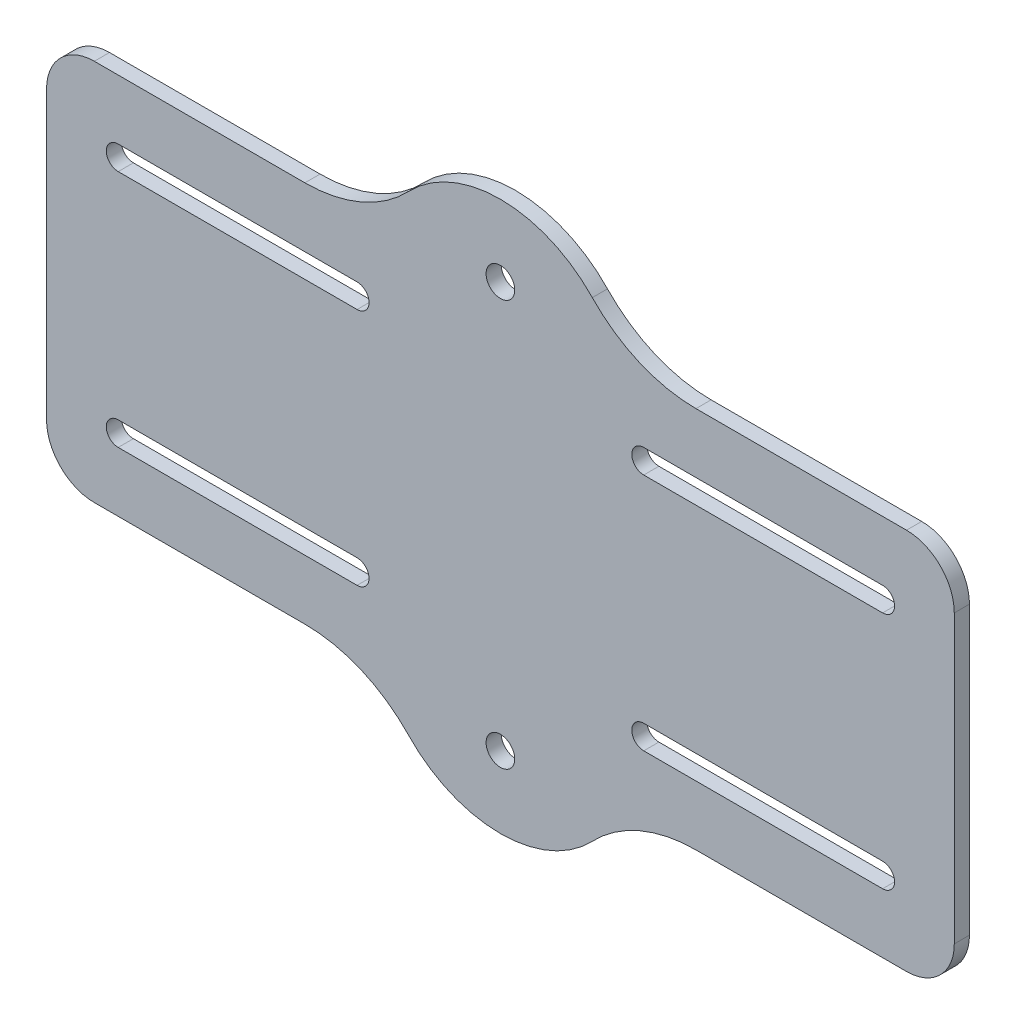
from build123d import *

# Parameters (mm, degrees)
SKETCH1_R           = 3
BOSS_EXTRUDE1_DEPTH = 3.175
FILLET1_R           = 10
FILLET2_R           = 30


with BuildPart() as part:
    # Sketch1 → Boss-Extrude1 (new body)
    with BuildSketch(Plane.XY):
        with BuildLine():
            Line((-95, -40), (-25, -40))
            ThreePointArc((-25, -40), (0, -57.5), (25, -40))
            Line((25, -40), (95, -40))
            Line((95, -40), (95, 40))
            Line((95, 40), (25, 40))
            ThreePointArc((25, 40), (0, 57.5), (-25, 40))
            Line((-25, 40), (-95, 40))
            Line((-95, 40), (-95, -40))
        make_face()
        with Locations((0, 42.5)):
            Circle(SKETCH1_R, mode=Mode.SUBTRACT)
        with Locations((0, -42.5)):
            Circle(SKETCH1_R, mode=Mode.SUBTRACT)
        with BuildLine():
            Line((30, 27.5), (80, 27.5))
            ThreePointArc((80, 27.5), (82.5, 25), (80, 22.5))
            Line((80, 22.5), (30, 22.5))
            ThreePointArc((30, 22.5), (27.5, 25), (30, 27.5))
        make_face(mode=Mode.SUBTRACT)
        with BuildLine():
            Line((30, -27.5), (80, -27.5))
            ThreePointArc((80, -27.5), (82.5, -25), (80, -22.5))
            Line((80, -22.5), (30, -22.5))
            ThreePointArc((30, -22.5), (27.5, -25), (30, -27.5))
        make_face(mode=Mode.SUBTRACT)
        with BuildLine():
            Line((-30, 27.5), (-80, 27.5))
            ThreePointArc((-80, 27.5), (-82.5, 25), (-80, 22.5))
            Line((-80, 22.5), (-30, 22.5))
            ThreePointArc((-30, 22.5), (-27.5, 25), (-30, 27.5))
        make_face(mode=Mode.SUBTRACT)
        with BuildLine():
            Line((-30, -27.5), (-80, -27.5))
            ThreePointArc((-80, -27.5), (-82.5, -25), (-80, -22.5))
            Line((-80, -22.5), (-30, -22.5))
            ThreePointArc((-30, -22.5), (-27.5, -25), (-30, -27.5))
        make_face(mode=Mode.SUBTRACT)
    extrude(amount=BOSS_EXTRUDE1_DEPTH)

    # Fillet1
    fillet1_edges = [part.edges().sort_by_distance(p)[0] for p in [
        (95, 40, 1.5875),
        (95, -40, 1.5875),
        (-95, -40, 1.5875),
        (-95, 40, 1.5875),
    ]]
    fillet(fillet1_edges, radius=FILLET1_R)

    # Fillet2
    fillet2_edges = [part.edges().sort_by_distance(p)[0] for p in [
        (25, -40, 1.5875),
        (-25, -40, 1.5875),
        (-25, 40, 1.5875),
        (25, 40, 1.5875),
    ]]
    fillet(fillet2_edges, radius=FILLET2_R)


solid = part.part
